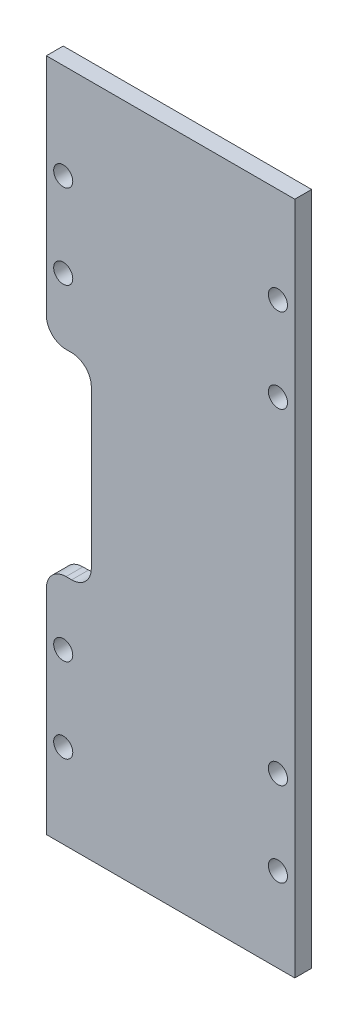
from build123d import *

# Parameters (mm, degrees)
SKETCH_D_W               = 44.2
SKETCH_D_H               = 120
BOSS_EXTRUDE1_DEPTH      = 3
M3_CLEARANCE_HOLE1_D     = 3.4
M3_CLEARANCE_HOLE1_DEPTH = 15
M3_CLEARANCE_HOLE1_TIP   = 1.021463052
SKETCH6_W                = 8
SKETCH6_H                = 35
CUT_EXTRUDE1_DEPTH       = 75.008813719
FILLET1_R                = 3.5


with BuildPart() as part:
    # Sketch d → Boss-Extrude1 (new body)
    with BuildSketch(Plane.XY):
        with Locations((0.312368929, 10.469782369)):
            Rectangle(SKETCH_D_W, SKETCH_D_H)
    extrude(amount=BOSS_EXTRUDE1_DEPTH)

    # M3 Clearance Hole1
    with Locations(Plane.XY.offset(3)):
        with Locations((-18.787631071, 53.469782369), (-18.787631071, 38.469782369), (-18.787631071, -19.530217631), (-18.787631071, -34.530217631), (19.412368929, -34.530217631), (19.412368929, -19.530217631), (19.412368929, 38.469782369), (19.412368929, 53.469782369)):
            Hole(M3_CLEARANCE_HOLE1_D / 2, depth=M3_CLEARANCE_HOLE1_DEPTH)
            with Locations((0, 0, -(M3_CLEARANCE_HOLE1_DEPTH + M3_CLEARANCE_HOLE1_TIP / 2))):  # 118° drill point
                Cone(0, M3_CLEARANCE_HOLE1_D / 2, M3_CLEARANCE_HOLE1_TIP, mode=Mode.SUBTRACT)

    # Sketch6 → Cut-Extrude1 (cut, through all)
    with BuildSketch(Plane.XY.offset(3)):
        with Locations((-17.787631071, 9.469782369)):
            Rectangle(SKETCH6_W, SKETCH6_H)
    extrude(amount=-CUT_EXTRUDE1_DEPTH, mode=Mode.SUBTRACT)

    # Fillet1
    fillet1_edges = [part.edges().sort_by_distance(p)[0] for p in [
        (-21.787631071, -8.030217631, 1.5),
        (-21.787631071, 26.969782369, 1.5),
        (-13.787631071, 26.969782369, 1.5),
        (-13.787631071, -8.030217631, 1.5),
    ]]
    fillet(fillet1_edges, radius=FILLET1_R)


solid = part.part
